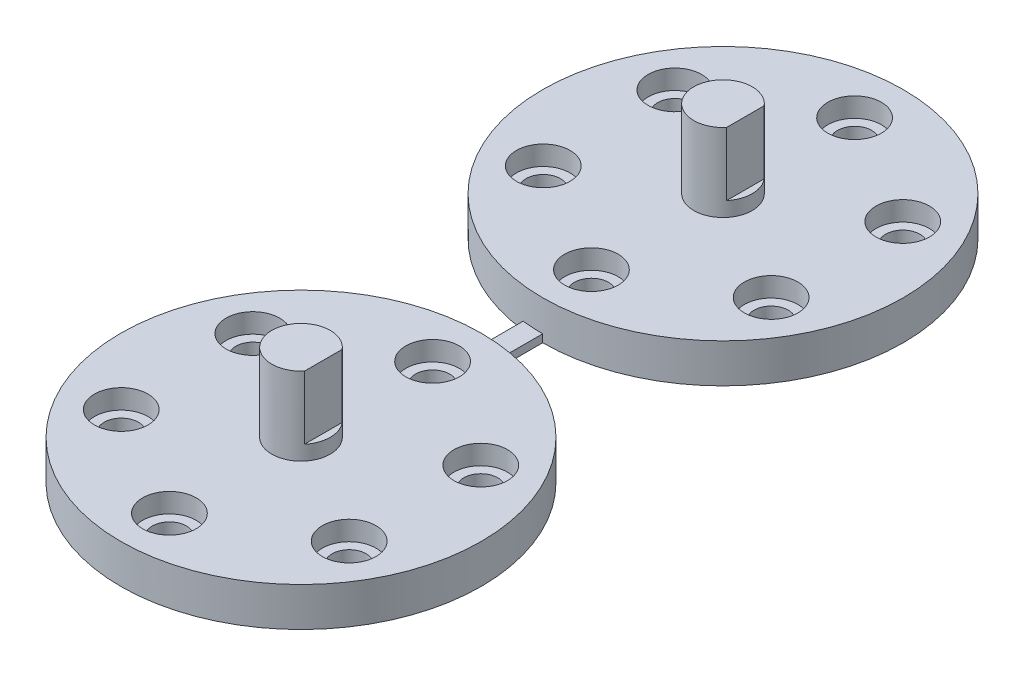
from build123d import *

# Parameters (mm, degrees)
SKETCH_1_W                   = 18.5
SKETCH_1_H                   = 4
HOLE_WIZARD_M3_1_D           = 3.5
HOLE_WIZARD_M3_1_CBORE_D     = 5.5
HOLE_WIZARD_M3_1_CBORE_DEPTH = 2
SKETCH_9_R                   = 4.078764036
EXTRUDE_2_DEPTH              = 4
SKETCH_10_R                  = 3
EXTRUDE_3_DEPTH              = 8
CUT_EXTRUDE_START            = -6.5
CUT_EXTRUDE_2_DEPTH          = 6.5
PATTERN_CIRCULAR_1_COUNT     = 3
PATTERN_CIRCULAR_1_ANGLE     = 120
SKETCH_13_W                  = 2.125984269
SKETCH_13_H                  = 7.532431529
EXTRUDE_4_DEPTH              = 0.8


with BuildPart() as part:
    # 草图1 → 旋转1 (revolve)
    with BuildSketch(Plane.XY.offset(0.922906258), mode=Mode.PRIVATE) as revolve_1_sk:
        with Locations((9.859359688, 2)):
            Rectangle(SKETCH_1_W, SKETCH_1_H)
    revolve(revolve_1_sk.sketch.rotate(Axis((0.609359688, 4, 0.922906258), (0, -1, 0)), 270), axis=Axis((0.609359688, 4, 0.922906258), (0, -1, 0)))

    # M3 六角头机械螺钉的柱形沉头孔1 (through all)
    with Locations(Plane(origin=(0, 4, 0), x_dir=(1, 0, 0), z_dir=(0, 1, 0))):
        with Locations((-11.081983263, -7.672906258), (12.300702639, -7.672906258), (0.609359688, 12.577093742)):
            hole_wizard_m3_1 = CounterBoreHole(HOLE_WIZARD_M3_1_D / 2, HOLE_WIZARD_M3_1_CBORE_D / 2, HOLE_WIZARD_M3_1_CBORE_DEPTH)

    # 草图9 → 凸台-拉伸2 (add)
    with BuildSketch(Plane.XZ):
        with Locations((0.609359688, 0.922906258)):
            Circle(SKETCH_9_R)
    extrude(amount=-EXTRUDE_2_DEPTH)

    # 草图10 → 凸台-拉伸3 (add)
    with BuildSketch(Plane(origin=(0, 4, 0), x_dir=(1, 0, 0), z_dir=(0, 1, 0))):
        with Locations(Location((0.609359688, -0.922906258, 0), (0, 0, 270))):
            Circle(SKETCH_10_R)
    extrude(amount=EXTRUDE_3_DEPTH)

    # 草图11 → 切除-拉伸2 (cut)
    with BuildSketch(Plane(origin=(0, 12, 0), x_dir=(1, 0, 0), z_dir=(0, 1, 0)).offset(CUT_EXTRUDE_START)):
        with BuildLine():
            Line((2.905866026, 1.007393885), (2.905866026, -2.853206401))
            ThreePointArc((2.905866026, -2.853206401), (3.609359688, -0.922906258), (2.905866026, 1.007393885))
        make_face()
    extrude(amount=CUT_EXTRUDE_2_DEPTH, mode=Mode.SUBTRACT)

    # 阵列(圆周)1: M3 六角头机械螺钉的柱形沉头孔1 ×3 about axis
    pattern_circular_1_axis = Axis((0.609359688, 0, 0.922906258), (0, -1, 0))
    for i in range(1, PATTERN_CIRCULAR_1_COUNT):
        add(hole_wizard_m3_1.rotate(pattern_circular_1_axis, i * PATTERN_CIRCULAR_1_ANGLE / (PATTERN_CIRCULAR_1_COUNT - 1)), mode=Mode.SUBTRACT)


with BuildPart() as body_2:
    # Move Body 3: copy of part
    add(part.part.moved(Location((0, 0, 43.295994543))))


with BuildPart() as part_1:
    add(part.part)

    add(body_2.part)  # 凸台-拉伸4 merges body 2
    # 草图13 → 凸台-拉伸4 (add)
    with BuildSketch(Plane.XZ):
        with Locations((-0.453632447, 22.075248032)):
            Rectangle(SKETCH_13_W, SKETCH_13_H)
    extrude(amount=-EXTRUDE_4_DEPTH)


solid = part_1.part
